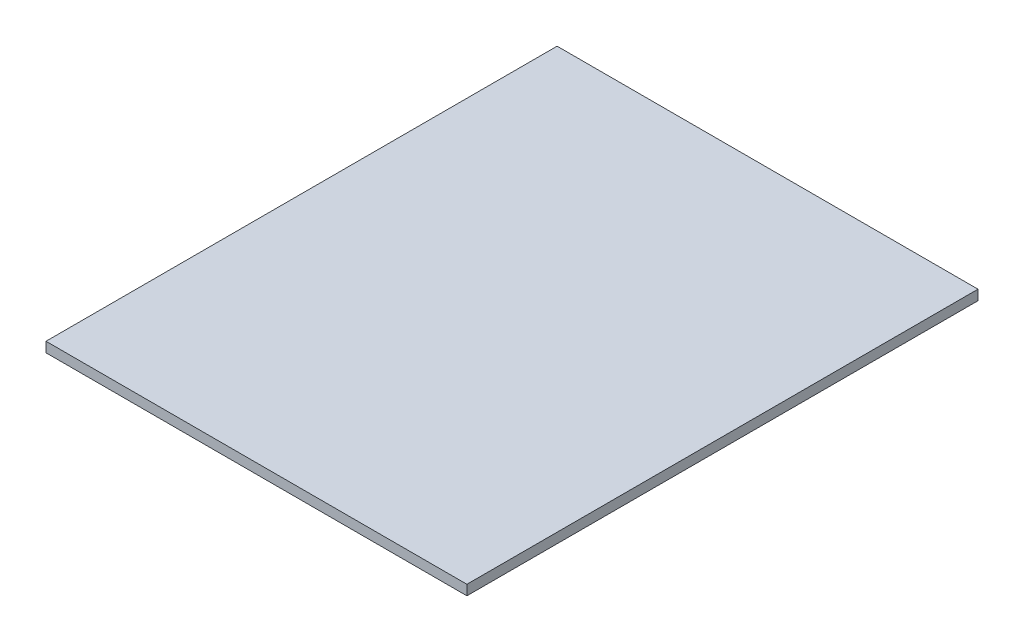
from build123d import *

# Parameters (mm, degrees)
ESQUISSE1_W        = 420
ESQUISSE1_H        = 510
BOSS_EXTRU_1_DEPTH = 10


with BuildPart() as part:
    # Esquisse1 → Boss.-Extru.1 (new body)
    with BuildSketch(Plane(origin=(0, 0, 0), x_dir=(1, 0, 0), z_dir=(0, 1, 0))):
        Rectangle(ESQUISSE1_W, ESQUISSE1_H)
    extrude(amount=BOSS_EXTRU_1_DEPTH)


solid = part.part
